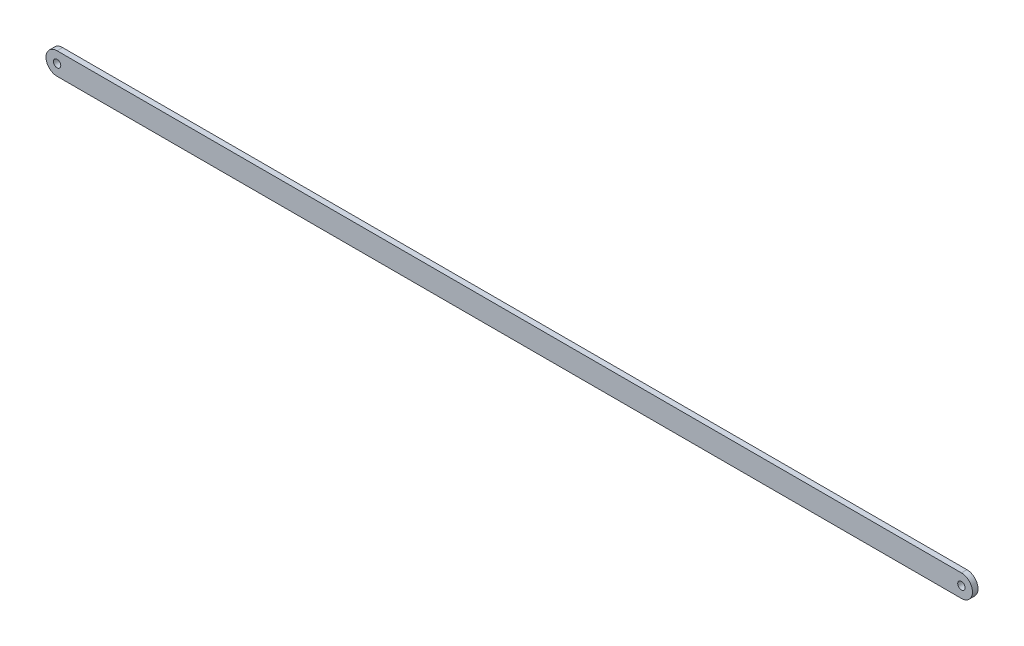
from build123d import *

# Parameters (mm, degrees)
SKETCH1_R           = 2
BOSS_EXTRUDE3_DEPTH = 3


with BuildPart() as part:
    # Sketch1 → Boss-Extrude3 (new body)
    with BuildSketch(Plane.XY):
        with BuildLine():
            Line((-35.312724167, 6), (454.687275833, 6))
            ThreePointArc((454.687275833, 6), (460.687275833, 0), (454.687275833, -6))
            Line((454.687275833, -6), (-35.312724167, -6))
            ThreePointArc((-35.312724167, -6), (-41.312724167, 0), (-35.312724167, 6))
        make_face()
        with Locations((-35.312724167, 0)):
            Circle(SKETCH1_R, mode=Mode.SUBTRACT)
        with Locations((454.687275833, 0)):
            Circle(SKETCH1_R, mode=Mode.SUBTRACT)
    extrude(amount=BOSS_EXTRUDE3_DEPTH)


solid = part.part
